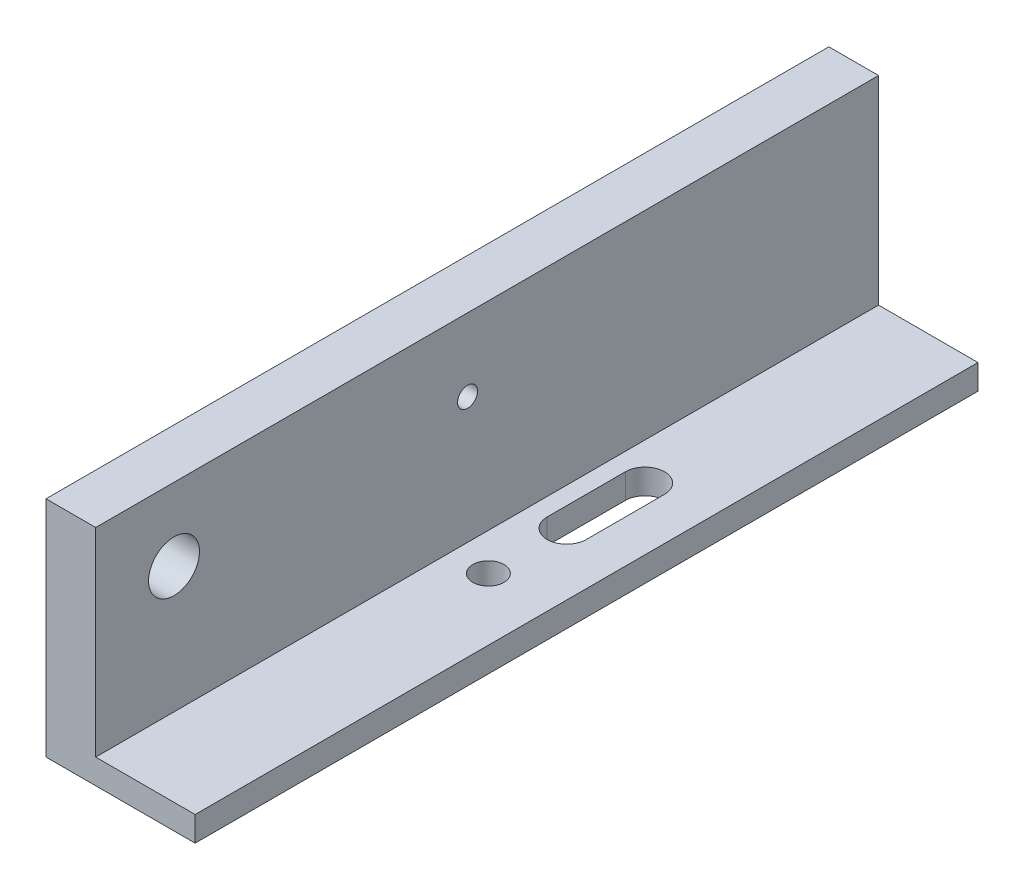
from build123d import *

# Parameters (mm, degrees)
SALIENTE_EXTRUIR1_DEPTH       = 100
SALIENTE_EXTRUIR2_DEPTH       = 6.35
TALADRO_ROSCADO_1_4_202_D     = 5.1054
TALADRO_ROSCADO_8_321_D       = 3.4544
TALADRO_ROSCADO_8_321_DEPTH   = 4.7625
TALADRO_ROSCADO_8_321_TIP     = 1.037806461
CROQUIS10_R                   = 6.5
CORTAR_EXTRUIR1_DEPTH         = 111.761638779
CORTAR_EXTRUIR2_DEPTH         = 6.35
TALADRO_ROSCADO_1_4_203_D     = 5.1054
TALADRO_ROSCADO_1_4_203_DEPTH = 13
TALADRO_ROSCADO_1_4_203_TIP   = 1.533816902
F_3_8_16_TAPPED_HOLE1_D       = 7.9375
F_3_8_16_TAPPED_HOLE1_DEPTH   = 23.81
F_3_8_16_TAPPED_HOLE1_TIP     = 2.384665582


with BuildPart() as part:
    # Croquis1 → Saliente-Extruir1 (new, symmetric)
    with BuildSketch(Plane.XY):
        Polygon((12.7, 28.575), (0, 28.575), (0, 0), (0, -28.575), (38.1, -28.575), (38.1, -22.225), (12.7, -22.225), (12.7, 22.225), align=None)
    extrude(amount=SALIENTE_EXTRUIR1_DEPTH, both=True)

    # Croquis2 → Saliente-Extruir2 (add, symmetric)
    with BuildSketch(Plane(origin=(0, 0, 0), x_dir=(1, 0, 0), z_dir=(0, 1, 0))):
        Polygon((0, 50), (0, -50), (-19.05, -30.95), (-19.05, 30.95), align=None)
    extrude(amount=SALIENTE_EXTRUIR2_DEPTH, both=True)

    # Taladro roscado 1/4-202 (through all)
    with Locations(Plane.XY.offset(50)):
        with Locations((-9.525, 0)):
            Hole(TALADRO_ROSCADO_1_4_202_D / 2)

    # Taladro roscado #8-321
    with Locations(Plane.ZY.offset(19.05)):
        with Locations((0, 0)):
            Hole(TALADRO_ROSCADO_8_321_D / 2, depth=TALADRO_ROSCADO_8_321_DEPTH)
            with Locations((0, 0, -(TALADRO_ROSCADO_8_321_DEPTH + TALADRO_ROSCADO_8_321_TIP / 2))):  # 118° drill point
                Cone(0, TALADRO_ROSCADO_8_321_D / 2, TALADRO_ROSCADO_8_321_TIP, mode=Mode.SUBTRACT)

    # Croquis10 → Cortar-Extruir1 (cut, through all)
    with BuildSketch(Plane.ZY):
        with Locations(Location((80, 10, 0), (0, 0, 270))):
            Circle(CROQUIS10_R)
    extrude(amount=-CORTAR_EXTRUIR1_DEPTH, mode=Mode.SUBTRACT)

    # Croquis13 → Cortar-Extruir2 (cut)
    with BuildSketch(Plane.XZ.offset(28.575)):
        with BuildLine():
            Line((27.225, -10.795039516), (27.225, -30.790076058))
            ThreePointArc((27.225, -30.790076058), (22.225, -35.790076058), (17.225, -30.790076058))
            Line((17.225, -30.790076058), (17.225, -10.795039516))
            ThreePointArc((17.225, -10.795039516), (22.225, -5.795039516), (27.225, -10.795039516))
        make_face()
    extrude(amount=-CORTAR_EXTRUIR2_DEPTH, mode=Mode.SUBTRACT)

    # Taladro roscado 1/4-203
    with Locations(Plane(origin=(12.7, 0, 0), x_dir=(0, 0, 1), z_dir=(1, 0, 0))):
        with Locations((5, -10)):
            Hole(TALADRO_ROSCADO_1_4_203_D / 2, depth=TALADRO_ROSCADO_1_4_203_DEPTH)
            with Locations((0, 0, -(TALADRO_ROSCADO_1_4_203_DEPTH + TALADRO_ROSCADO_1_4_203_TIP / 2))):  # 118° drill point
                Cone(0, TALADRO_ROSCADO_1_4_203_D / 2, TALADRO_ROSCADO_1_4_203_TIP, mode=Mode.SUBTRACT)

    # 3/8-16 Tapped Hole1
    with Locations(Plane(origin=(0, -28.575, 0), x_dir=(-1, 0, 0), z_dir=(0, -1, 0))):
        with Locations((-22.225, -9.204960484)):
            Hole(F_3_8_16_TAPPED_HOLE1_D / 2, depth=F_3_8_16_TAPPED_HOLE1_DEPTH)
            with Locations((0, 0, -(F_3_8_16_TAPPED_HOLE1_DEPTH + F_3_8_16_TAPPED_HOLE1_TIP / 2))):  # 118° drill point
                Cone(0, F_3_8_16_TAPPED_HOLE1_D / 2, F_3_8_16_TAPPED_HOLE1_TIP, mode=Mode.SUBTRACT)


solid = part.part
